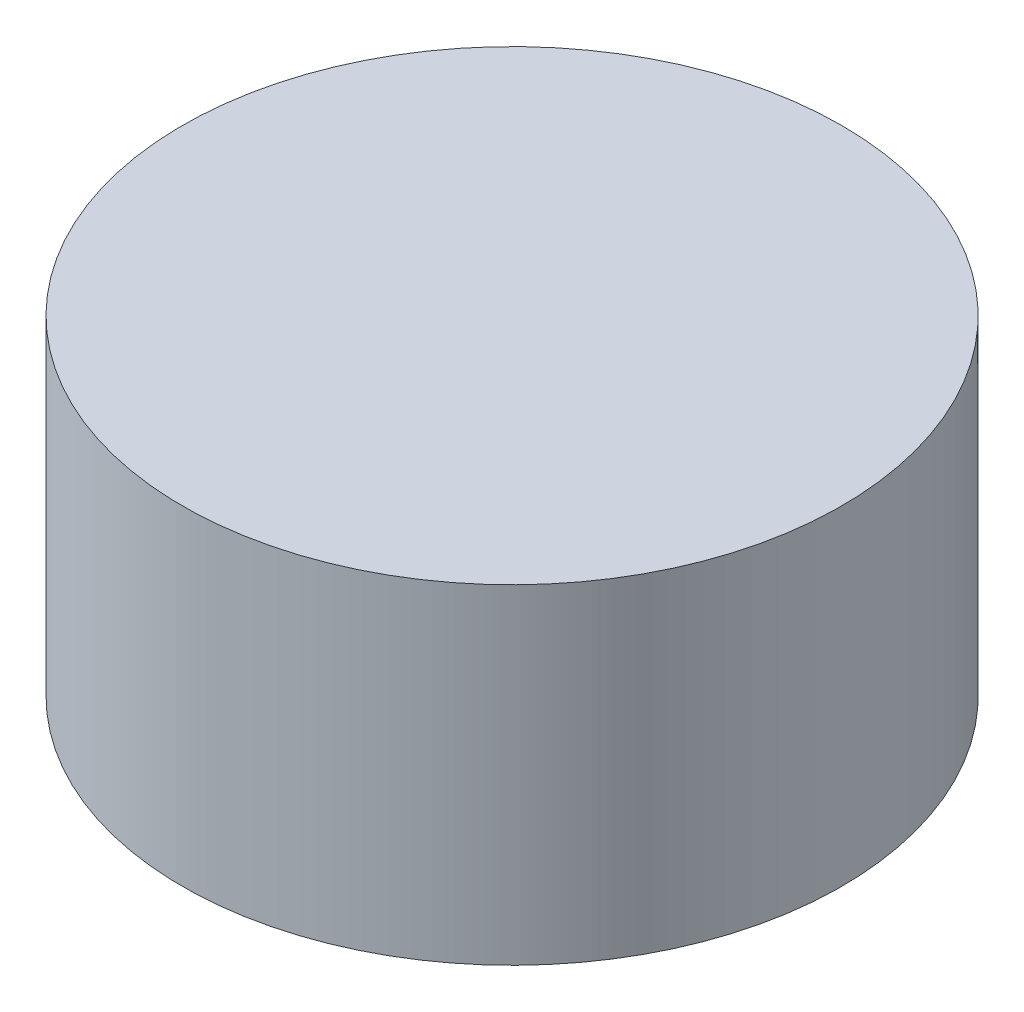
from build123d import *


with BuildPart() as part:
    # Esquisse1 → Base-Révolution (revolve)
    with BuildSketch(Plane.XY):
        with BuildLine():
            Line((-6.92820323, -4), (-15, -4))
            Line((-15, -4), (-15, 11))
            Line((-15, 11), (0, 11))
            Line((0, 11), (0, 8))
            ThreePointArc((0, 8), (-6.92820323, 4), (-6.92820323, -4))
        make_face()
    revolve(axis=Axis((0, -20.077487437, 0), (0, 1, 0)))


solid = part.part
